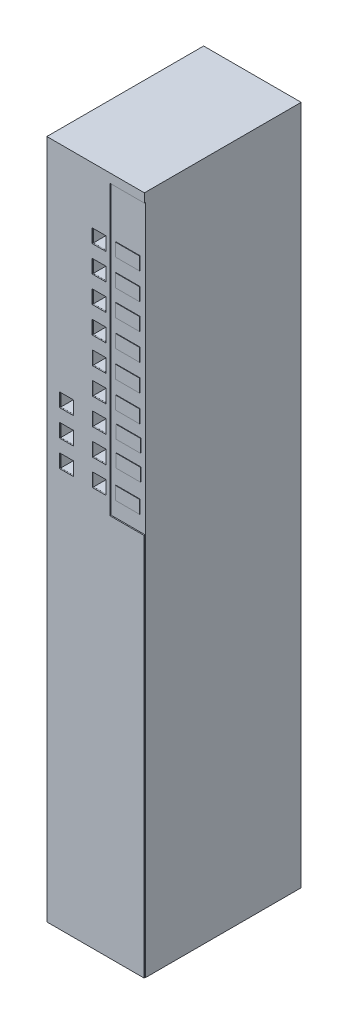
from build123d import *

# Parameters (mm, degrees)
CROQUIS1_W              = 178.587886288
CROQUIS1_H              = 1245.447721363
CROQUIS1_W_2            = 25
CROQUIS1_H_2            = 25
SALIENTE_EXTRUIR2_DEPTH = 285
CROQUIS2_W              = 178.587886288
CROQUIS2_H              = 552.844893509
SALIENTE_EXTRUIR3_DEPTH = 1
CROQUIS5_W              = 25
CROQUIS5_H              = 25
SALIENTE_EXTRUIR4_DEPTH = 2
CROQUIS10_W             = 44.39506519
CROQUIS10_H             = 23.654322964
CROQUIS10_H_2           = 23.654322963
SALIENTE_EXTRUIR5_DEPTH = 1


with BuildPart() as part:
    # Croquis1 → Saliente-Extruir2 (new body)
    with BuildSketch(Plane.XY):
        with Locations((121.784181129, -381.025603562)):
            Rectangle(CROQUIS1_W, CROQUIS1_H)
        with Locations((174.990237985, -163.957841157)):
            Rectangle(CROQUIS1_W_2, CROQUIS1_H_2, mode=Mode.SUBTRACT)
        with Locations((115.437079382, 126.027179256)):
            Rectangle(CROQUIS1_W_2, CROQUIS1_H_2, mode=Mode.SUBTRACT)
        with Locations((115.437079382, 77.694179256)):
            Rectangle(CROQUIS1_W_2, CROQUIS1_H_2, mode=Mode.SUBTRACT)
        with Locations((115.437079382, 29.364179256)):
            Rectangle(CROQUIS1_W_2, CROQUIS1_H_2, mode=Mode.SUBTRACT)
        with Locations((115.437079382, -18.965820744)):
            Rectangle(CROQUIS1_W_2, CROQUIS1_H_2, mode=Mode.SUBTRACT)
        with Locations((114.990237985, -67.291541157)):
            Rectangle(CROQUIS1_W_2, CROQUIS1_H_2, mode=Mode.SUBTRACT)
        with Locations((114.990237985, -115.624841157)):
            Rectangle(CROQUIS1_W_2, CROQUIS1_H_2, mode=Mode.SUBTRACT)
        with Locations((114.990237985, -163.957841157)):
            Rectangle(CROQUIS1_W_2, CROQUIS1_H_2, mode=Mode.SUBTRACT)
        with Locations((114.990237985, -212.287841157)):
            Rectangle(CROQUIS1_W_2, CROQUIS1_H_2, mode=Mode.SUBTRACT)
        with Locations((114.990237985, -260.617841157)):
            Rectangle(CROQUIS1_W_2, CROQUIS1_H_2, mode=Mode.SUBTRACT)
        with Locations((174.990237985, -212.287841157)):
            Rectangle(CROQUIS1_W_2, CROQUIS1_H_2, mode=Mode.SUBTRACT)
        with Locations((174.990237985, -260.617841157)):
            Rectangle(CROQUIS1_W_2, CROQUIS1_H_2, mode=Mode.SUBTRACT)
    extrude(amount=-SALIENTE_EXTRUIR2_DEPTH)

    # Croquis2 → Saliente-Extruir3 (add)
    with BuildSketch(Plane(origin=(0, 0, -285), x_dir=(-1, 0, 0), z_dir=(0, 0, -1))):
        with Locations((-121.784181129, -34.724189635)):
            Rectangle(CROQUIS2_W, CROQUIS2_H)
    extrude(amount=-SALIENTE_EXTRUIR3_DEPTH)

    # Croquis5 → Saliente-Extruir4 (add)
    with BuildSketch(Plane.XY):
        Polygon((40.133927115, 241.69825712), (187.776914698, 241.69825712), (211.134564186, 241.69825712), (211.134564186, -1003.749464243), (33.378525324, -1003.749464243), (33.378525324, -301.90284108), (95.791395616, -301.90284108), (95.791395616, 225.342265798), (32.490237985, 225.342265798), (32.490237985, 241.69825712), align=None)
        with Locations((175.276914698, -164.067102515)):
            Rectangle(CROQUIS5_W, CROQUIS5_H, mode=Mode.SUBTRACT)
        with Locations((115.723756094, 125.917917897)):
            Rectangle(CROQUIS5_W, CROQUIS5_H, mode=Mode.SUBTRACT)
        with Locations((115.723756094, 77.584917897)):
            Rectangle(CROQUIS5_W, CROQUIS5_H, mode=Mode.SUBTRACT)
        with Locations((115.723756094, 29.254917897)):
            Rectangle(CROQUIS5_W, CROQUIS5_H, mode=Mode.SUBTRACT)
        with Locations((115.723756094, -19.075082103)):
            Rectangle(CROQUIS5_W, CROQUIS5_H, mode=Mode.SUBTRACT)
        with Locations((115.276914698, -67.400802515)):
            Rectangle(CROQUIS5_W, CROQUIS5_H, mode=Mode.SUBTRACT)
        with Locations((115.276914698, -115.734102515)):
            Rectangle(CROQUIS5_W, CROQUIS5_H, mode=Mode.SUBTRACT)
        with Locations((115.276914698, -164.067102515)):
            Rectangle(CROQUIS5_W, CROQUIS5_H, mode=Mode.SUBTRACT)
        with Locations((115.276914698, -212.397102515)):
            Rectangle(CROQUIS5_W, CROQUIS5_H, mode=Mode.SUBTRACT)
        with Locations((115.276914698, -260.727102515)):
            Rectangle(CROQUIS5_W, CROQUIS5_H, mode=Mode.SUBTRACT)
        with Locations((175.276914698, -212.397102515)):
            Rectangle(CROQUIS5_W, CROQUIS5_H, mode=Mode.SUBTRACT)
        with Locations((175.276914698, -260.727102515)):
            Rectangle(CROQUIS5_W, CROQUIS5_H, mode=Mode.SUBTRACT)
    extrude(amount=SALIENTE_EXTRUIR4_DEPTH)

    # Croquis10 → Saliente-Extruir5 (add)
    with BuildSketch(Plane.XY):
        with Locations((64.427271282, 75.386790193)):
            Rectangle(CROQUIS10_W, CROQUIS10_H)
        with Locations((64.427271282, -20.708896845)):
            Rectangle(CROQUIS10_W, CROQUIS10_H_2)
        with Locations((64.427271282, -69.495937956)):
            Rectangle(CROQUIS10_W, CROQUIS10_H_2)
        with Locations((64.427271282, -118.282979068)):
            Rectangle(CROQUIS10_W, CROQUIS10_H_2)
        with Locations((62.948876097, -164.113229809)):
            Rectangle(CROQUIS10_W, CROQUIS10_H_2)
        with Locations((62.948876097, -209.94348055)):
            Rectangle(CROQUIS10_W, CROQUIS10_H_2)
        with Locations((64.427271282, 28.078144267)):
            Rectangle(CROQUIS10_W, CROQUIS10_H_2)
        with Locations((64.427271282, 124.173831305)):
            Rectangle(CROQUIS10_W, CROQUIS10_H_2)
        with Locations((64.427271282, -261.687312031)):
            Rectangle(CROQUIS10_W, CROQUIS10_H)
    extrude(amount=SALIENTE_EXTRUIR5_DEPTH)


with BuildPart() as body_2:
    # Simetría1: mirrored copy
    add(part.part.mirror(Plane(origin=(311.078124273, 0, 0), x_dir=(0, 0, 1), z_dir=(1, 0, 0))))


solid = body_2.part
